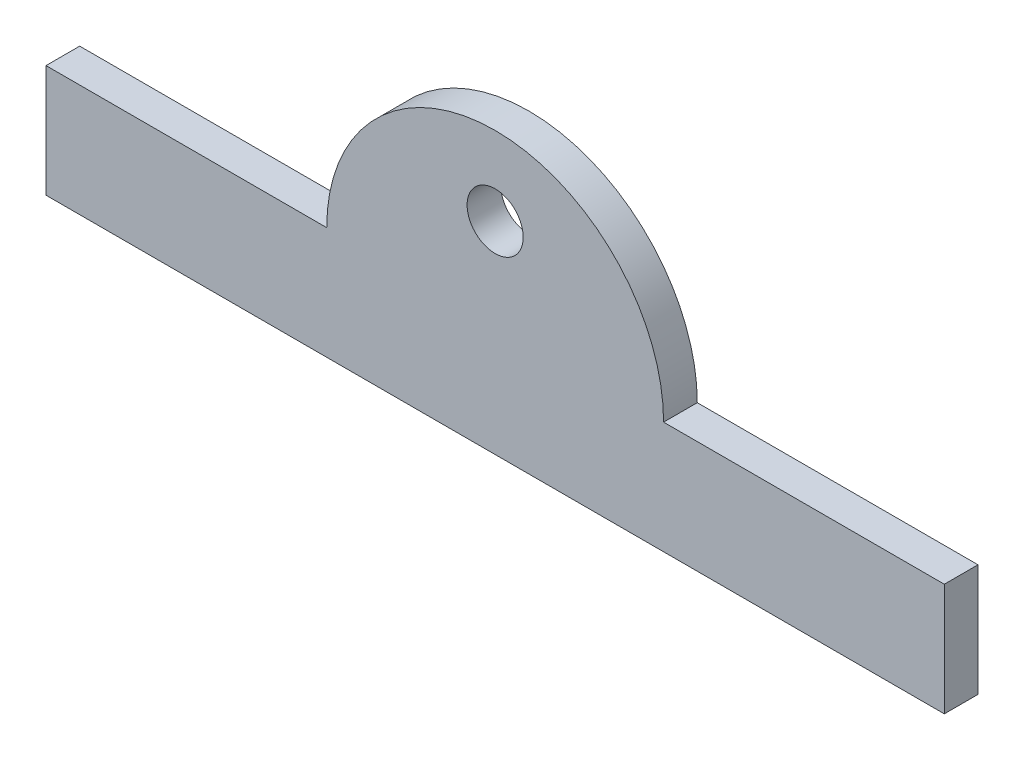
from build123d import *

# Parameters (mm, degrees)
SKETCH_1_W      = 80
SKETCH_1_H      = 3
EXTRUDE_1_DEPTH = 5
SKETCH_3_R      = 2.5
EXTRUDE_2_DEPTH = 1.5


with BuildPart() as part:
    # 草图1 → 凸台-拉伸1 (new, symmetric)
    with BuildSketch(Plane(origin=(0, 0, 0), x_dir=(1, 0, 0), z_dir=(0, 1, 0))):
        Rectangle(SKETCH_1_W, SKETCH_1_H)
    extrude(amount=EXTRUDE_1_DEPTH, both=True)

    # 草图3 → 凸台-拉伸2 (add, symmetric)
    with BuildSketch(Plane.XY):
        with BuildLine():
            Line((-15, 5), (15, 5))
            ThreePointArc((15, 5), (0, 20), (-15, 5))
        make_face()
        with Locations((0, 13)):
            Circle(SKETCH_3_R, mode=Mode.SUBTRACT)
    extrude(amount=EXTRUDE_2_DEPTH, both=True)


solid = part.part
